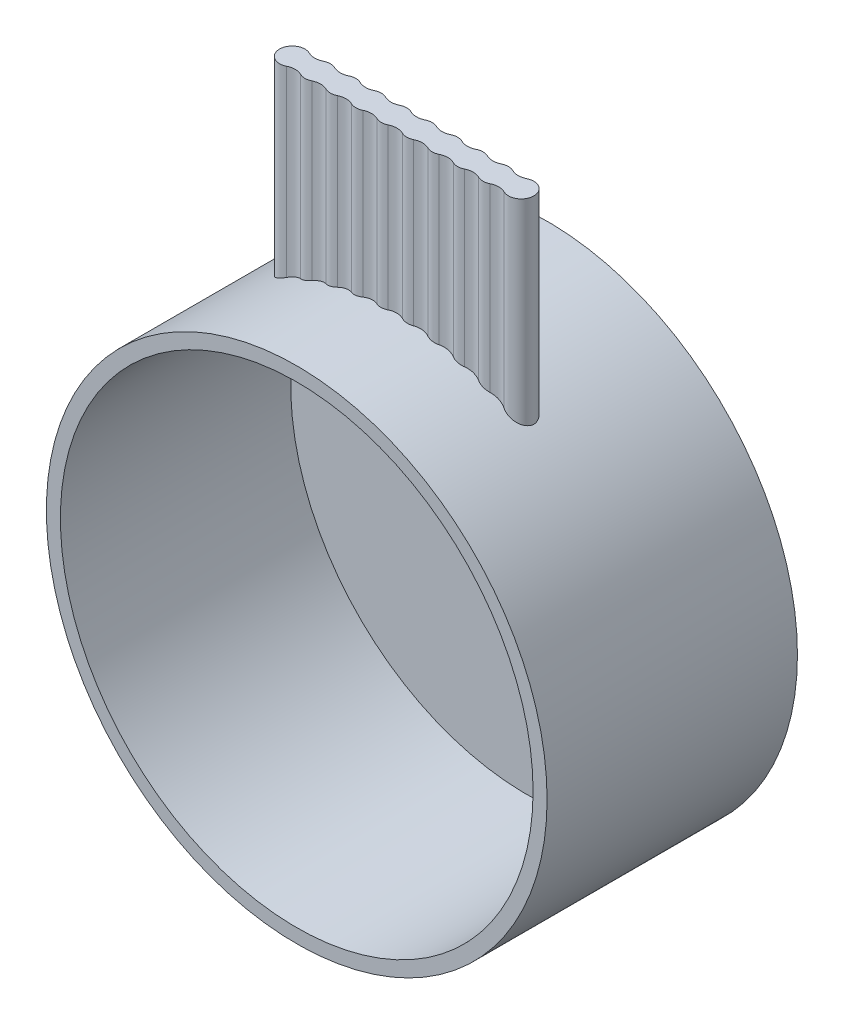
from build123d import *

# Parameters (mm, degrees)
ESQUISSE1_R             = 12.5
BOSS_EXTRU_1_DEPTH      = 1
ESQUISSE2_R             = 12.5
ESQUISSE2_R_2           = 11.8
BOSS_EXTRU_2_DEPTH      = 11.5
BOSS_EXTRU_4_DEPTH      = 8
BOSS_EXTRU_4_DEPTH_BACK = 3


with BuildPart() as part:
    # Esquisse1 → Boss.-Extru.1 (new body)
    with BuildSketch(Plane.XY):
        Circle(ESQUISSE1_R)
    extrude(amount=BOSS_EXTRU_1_DEPTH)

    # Esquisse2 → Boss.-Extru.2 (add)
    with BuildSketch(Plane.XY.offset(1)):
        Circle(ESQUISSE2_R)
        Circle(ESQUISSE2_R_2, mode=Mode.SUBTRACT)
    extrude(amount=BOSS_EXTRU_2_DEPTH)

    # Esquisse3 → Boss.-Extru.4 (add, two sides: drawn at the far end of the back side and taken through both)
    with BuildSketch(Plane(origin=(0, 12.5, 0), x_dir=(-1, 0, 0), z_dir=(0, 1, 0)).offset(-BOSS_EXTRU_4_DEPTH_BACK)):
        with BuildLine():
            ThreePointArc((5.205197829, 6.66788888), (6.121190861, 7.237334151), (5.205197829, 7.806779422))
            ThreePointArc((5.205197829, 7.806779422), (4.851190861, 7.724190786), (4.497183892, 7.806779422))
            ThreePointArc((4.497183892, 7.806779422), (4.216190861, 7.872334151), (3.935197829, 7.806779422))
            ThreePointArc((3.935197829, 7.806779422), (3.581190861, 7.724190786), (3.227183892, 7.806779422))
            ThreePointArc((3.227183892, 7.806779422), (2.946190861, 7.872334151), (2.665197829, 7.806779422))
            ThreePointArc((2.665197829, 7.806779422), (2.311190861, 7.724190786), (1.957183892, 7.806779422))
            ThreePointArc((1.957183892, 7.806779422), (1.676190861, 7.872334151), (1.395197829, 7.806779422))
            ThreePointArc((1.395197829, 7.806779422), (1.041190861, 7.724190786), (0.687183892, 7.806779422))
            ThreePointArc((0.687183892, 7.806779422), (0.406190861, 7.872334151), (0.125197829, 7.806779422))
            ThreePointArc((0.125197829, 7.806779422), (-0.228809139, 7.724190786), (-0.582816108, 7.806779422))
            ThreePointArc((-0.582816108, 7.806779422), (-0.863809139, 7.872334151), (-1.144802171, 7.806779422))
            ThreePointArc((-1.144802171, 7.806779422), (-1.498809139, 7.724190786), (-1.852816108, 7.806779422))
            ThreePointArc((-1.852816108, 7.806779422), (-2.133809139, 7.872334151), (-2.414802171, 7.806779422))
            ThreePointArc((-2.414802171, 7.806779422), (-2.768809139, 7.724190786), (-3.122816108, 7.806779422))
            ThreePointArc((-3.122816108, 7.806779422), (-3.403809139, 7.872334151), (-3.684802171, 7.806779422))
            ThreePointArc((-3.684802171, 7.806779422), (-4.038809139, 7.724190786), (-4.392816108, 7.806779422))
            ThreePointArc((-4.392816108, 7.806779422), (-4.673809139, 7.872334151), (-4.954802171, 7.806779422))
            ThreePointArc((-4.954802171, 7.806779422), (-5.308809139, 7.724190786), (-5.662816108, 7.806779422))
            ThreePointArc((-5.662816108, 7.806779422), (-6.578809139, 7.237334151), (-5.662816108, 6.66788888))
            ThreePointArc((-5.662816108, 6.66788888), (-5.308809139, 6.750477516), (-4.954802171, 6.66788888))
            ThreePointArc((-4.954802171, 6.66788888), (-4.673809139, 6.602334151), (-4.392816108, 6.66788888))
            ThreePointArc((-4.392816108, 6.66788888), (-4.038809139, 6.750477516), (-3.684802171, 6.66788888))
            ThreePointArc((-3.684802171, 6.66788888), (-3.403809139, 6.602334151), (-3.122816108, 6.66788888))
            ThreePointArc((-3.122816108, 6.66788888), (-2.768809139, 6.750477516), (-2.414802171, 6.66788888))
            ThreePointArc((-2.414802171, 6.66788888), (-2.133809139, 6.602334151), (-1.852816108, 6.66788888))
            ThreePointArc((-1.852816108, 6.66788888), (-1.498809139, 6.750477516), (-1.144802171, 6.66788888))
            ThreePointArc((-1.144802171, 6.66788888), (-0.863809139, 6.602334151), (-0.582816108, 6.66788888))
            ThreePointArc((-0.582816108, 6.66788888), (-0.228809139, 6.750477516), (0.125197829, 6.66788888))
            ThreePointArc((0.125197829, 6.66788888), (0.406190861, 6.602334151), (0.687183892, 6.66788888))
            ThreePointArc((0.687183892, 6.66788888), (1.041190861, 6.750477516), (1.395197829, 6.66788888))
            ThreePointArc((1.395197829, 6.66788888), (1.676190861, 6.602334151), (1.957183892, 6.66788888))
            ThreePointArc((1.957183892, 6.66788888), (2.311190861, 6.750477516), (2.665197829, 6.66788888))
            ThreePointArc((2.665197829, 6.66788888), (2.946190861, 6.602334151), (3.227183892, 6.66788888))
            ThreePointArc((3.227183892, 6.66788888), (3.581190861, 6.750477516), (3.935197829, 6.66788888))
            ThreePointArc((3.935197829, 6.66788888), (4.216190861, 6.602334151), (4.497183892, 6.66788888))
            ThreePointArc((4.497183892, 6.66788888), (4.851190861, 6.750477516), (5.205197829, 6.66788888))
        make_face()
    extrude(amount=BOSS_EXTRU_4_DEPTH + BOSS_EXTRU_4_DEPTH_BACK)


solid = part.part
